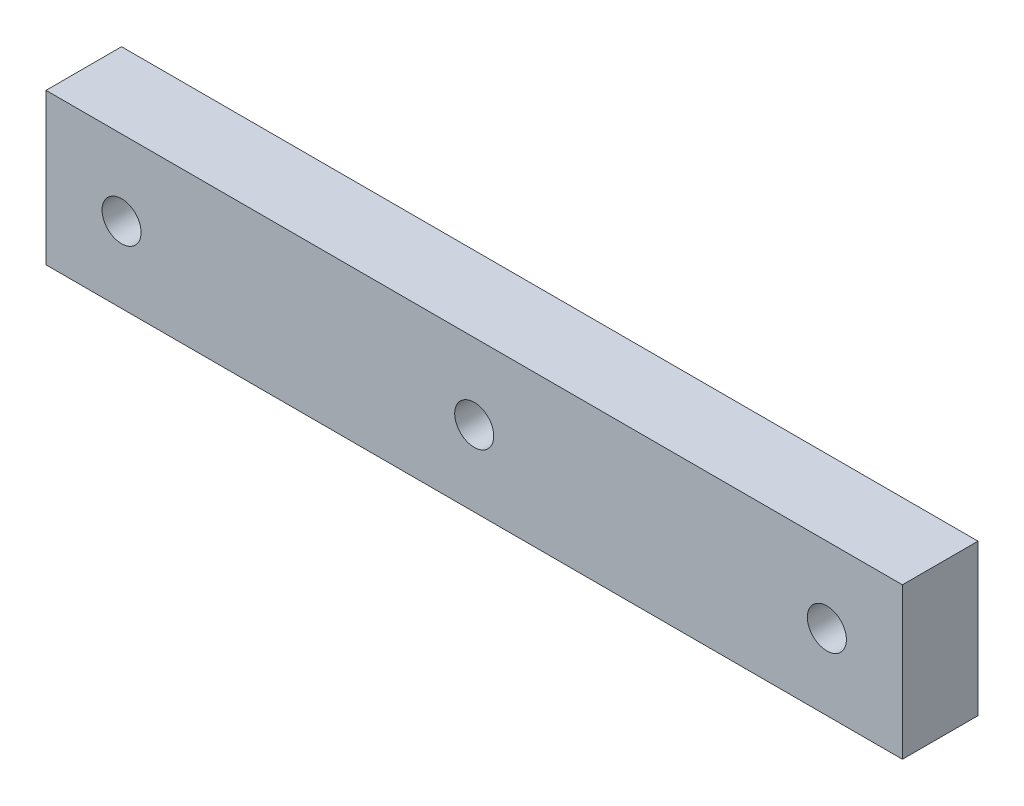
from build123d import *

# Parameters (mm, degrees)
SZKIC1_W                    = 68
SZKIC1_H                    = 12
DODANIE_WYCI_GNI_CIE1_DEPTH = 6
SZKIC2_R                    = 1.55
WYTNIJ_WYCI_GNI_CIE1_DEPTH  = 6


with BuildPart() as part:
    # Szkic1 → Dodanie-wyciągnięcie1 (new body)
    with BuildSketch(Plane.XY):
        with Locations((81.201456632, 11.703969636)):
            Rectangle(SZKIC1_W, SZKIC1_H)
    extrude(amount=DODANIE_WYCI_GNI_CIE1_DEPTH)

    # Szkic2 → Wytnij-wyciągnięcie1 (cut)
    with BuildSketch(Plane.XY.offset(6)):
        with Locations((109.201456632, 11.703969636)):
            Circle(SZKIC2_R)
        with Locations((53.201456632, 11.703969636)):
            Circle(SZKIC2_R)
        with Locations((81.201456632, 11.703969636)):
            Circle(SZKIC2_R)
    extrude(amount=-WYTNIJ_WYCI_GNI_CIE1_DEPTH, mode=Mode.SUBTRACT)


solid = part.part
